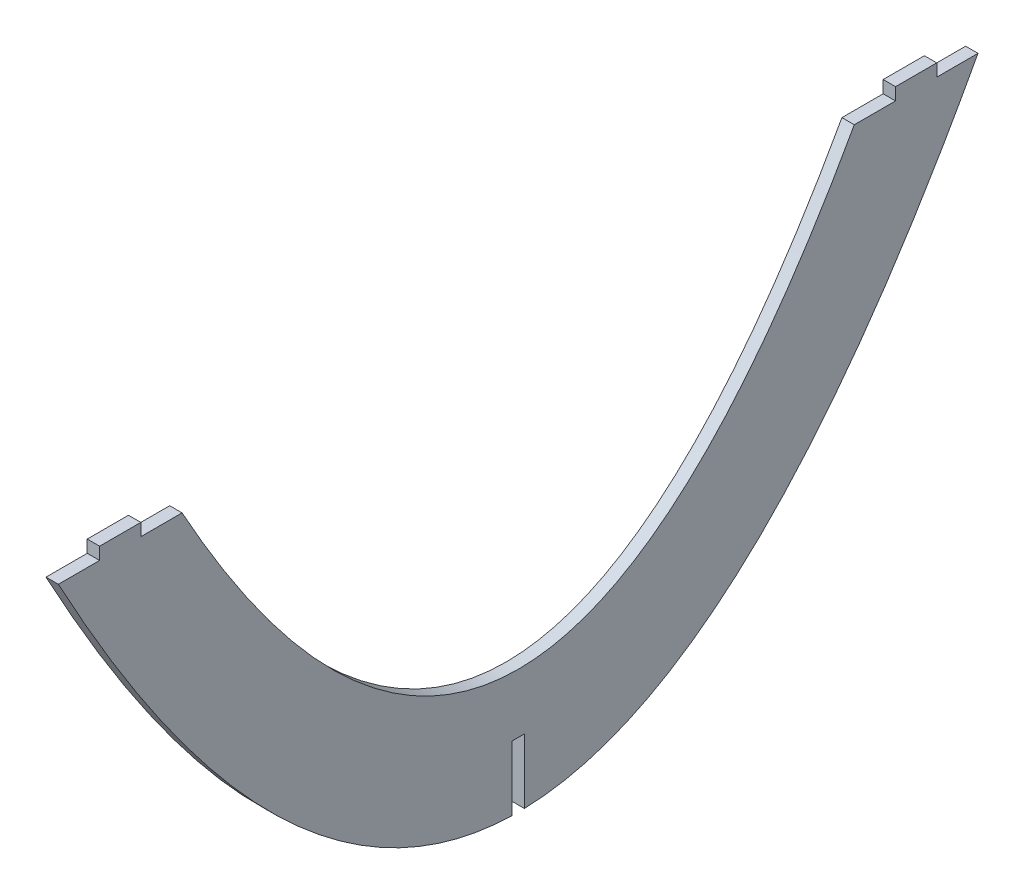
from build123d import *

# Parameters (mm, degrees)
EXTRUDE_1_DEPTH     = 3
EXTRUDE_2_DEPTH     = 3
CUT_EXTRUDE_1_DEPTH = 167.048432022


with BuildPart() as part:
    # 草图1 → 凸台-拉伸1 (new body)
    with BuildSketch(Plane(origin=(0, 0, 0), x_dir=(0, 0, -1), z_dir=(1, 0, 0))):
        with BuildLine():
            Line((-111.5127858, 119.995854941), (-81.510489631, 119.995854941))
            add(Edge.make_bspline(
                [(-81.510489631, 119.995854941), (0, -27.247544941), (81.510489631, 119.995854941)],
                knots=[0.173392056, 0.173392056, 0.173392056, 0.826607944, 0.826607944, 0.826607944], degree=2))
            Line((81.510489631, 119.995854941), (111.5127858, 119.995854941))
            add(Edge.make_bspline(
                [(-111.5127858, 119.995854941), (0, -87.247544941), (111.5127858, 119.995854941)],
                knots=[0.057120868, 0.057120868, 0.057120868, 0.942879132, 0.942879132, 0.942879132], degree=2))
        make_face()
    extrude(amount=EXTRUDE_1_DEPTH)

    # 草图2 → 凸台-拉伸2 (add)
    with BuildSketch(Plane(origin=(0, 119.995854941, 0), x_dir=(1, 0, 0), z_dir=(0, 1, 0))):
        Polygon((0, 91.511637716), (1.000038267, 91.511637716), (1.999961733, 101.511637716), (0, 101.511637716), align=None)
        Polygon((1.999961733, 101.511637716), (1.000038267, 91.511637716), (3, 91.511637716), (3, 101.511637716), align=None)
        Polygon((0, -101.511637716), (1.000038267, -101.511637716), (1.999961733, -91.511637716), (0, -91.511637716), align=None)
        Polygon((1.999961733, -91.511637716), (1.000038267, -101.511637716), (3, -101.511637716), (3, -91.511637716), align=None)
    extrude(amount=EXTRUDE_2_DEPTH)

    # 草图3 → 切除-拉伸1 (cut, through all)
    with BuildSketch(Plane.ZY):
        with BuildLine():
            Line((1.5, 32.06853615), (-1.5, 32.06853615))
            Line((-1.5, 32.06853615), (-1.5, 16.39290425))
            add(Edge.make_bspline(
                [(-1.5, 16.39290425), (0, 16.35540575), (1.5, 16.39290425)],
                knots=[0.494042668, 0.494042668, 0.494042668, 0.505957332, 0.505957332, 0.505957332], degree=2))
            Line((1.5, 16.39290425), (1.5, 32.06853615))
        make_face()
    extrude(amount=-CUT_EXTRUDE_1_DEPTH, mode=Mode.SUBTRACT)


solid = part.part
